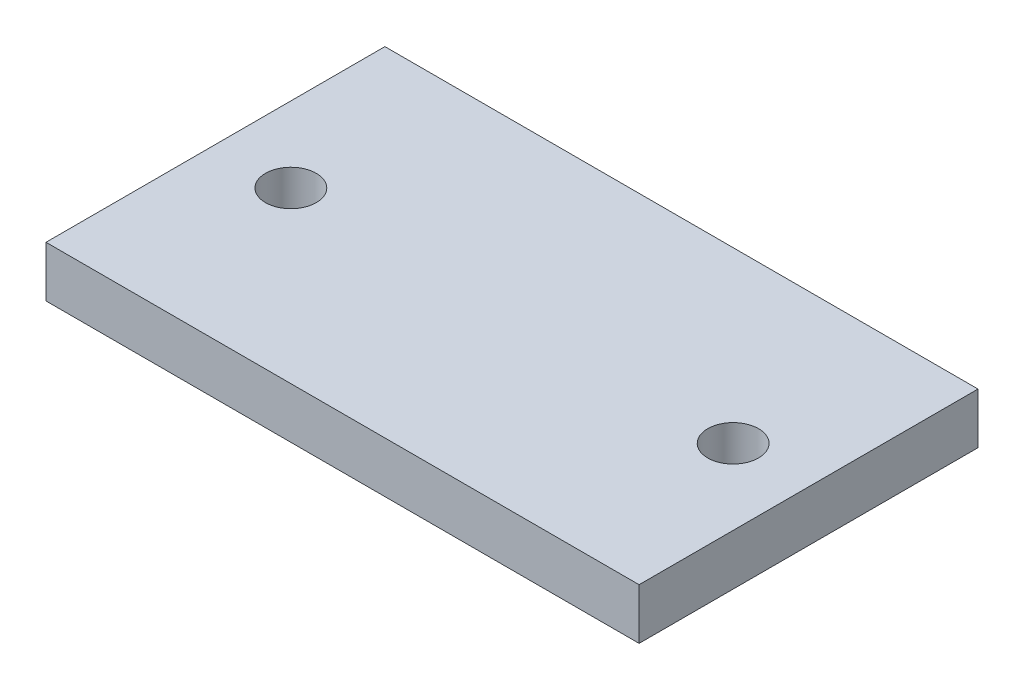
from build123d import *

# Parameters (mm, degrees)
SKETCH2_W           = 35
SKETCH2_H           = 20
SKETCH2_R           = 1.5
BOSS_EXTRUDE1_DEPTH = 3


with BuildPart() as part:
    # Sketch2 → Boss-Extrude1 (new body)
    with BuildSketch(Plane(origin=(0, 0, 0), x_dir=(1, 0, 0), z_dir=(0, 1, 0))):
        Rectangle(SKETCH2_W, SKETCH2_H)
        with Locations(Location((-13.05, 0, 0), (0, 0, 270))):
            Circle(SKETCH2_R, mode=Mode.SUBTRACT)
        with Locations(Location((13.05, 0, 0), (0, 0, 270))):
            Circle(SKETCH2_R, mode=Mode.SUBTRACT)
    extrude(amount=BOSS_EXTRUDE1_DEPTH)


solid = part.part
